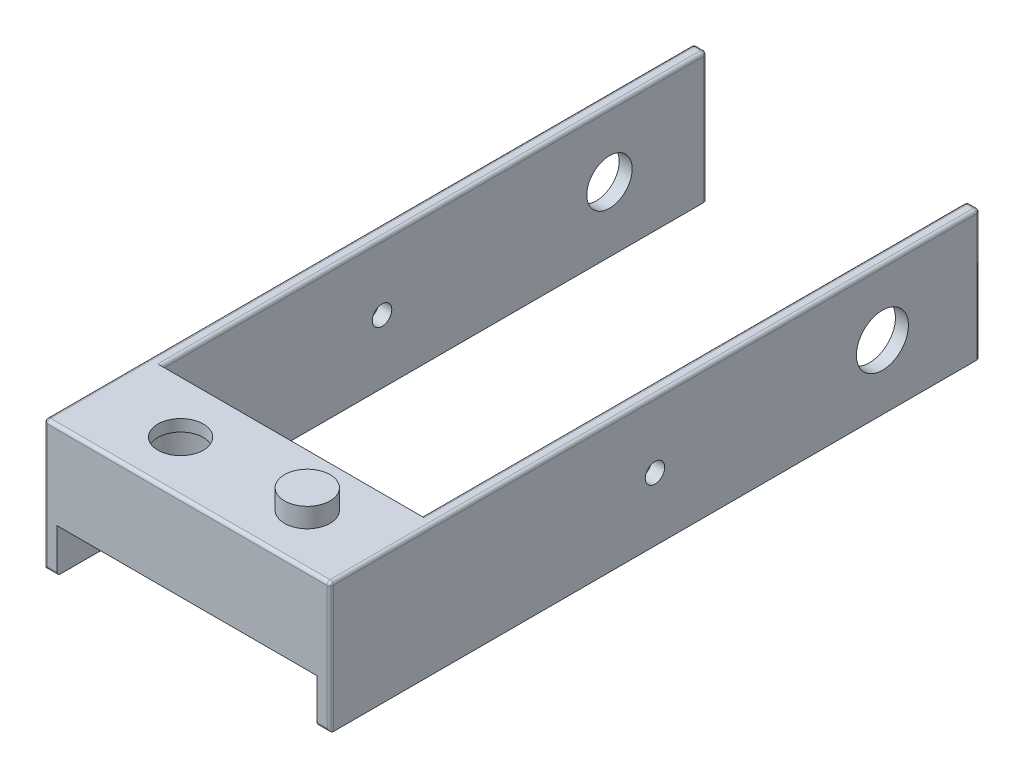
from build123d import *

# Parameters (mm, degrees)
SKETCH1_W           = 40
SKETCH1_H           = 16
BOSS_EXTRUDE1_DEPTH = 13.3
CUT_EXTRUDE2_DEPTH  = 11.5
SKETCH3_R           = 3.5
CUT_EXTRUDE3_DEPTH  = 24.8
SKETCH4_W           = 21
SKETCH4_H           = 12
CUT_EXTRUDE4_DEPTH  = 4
SKETCH5_W           = 100
SKETCH5_H           = 20
BOSS_EXTRUDE2_DEPTH = 2
SKETCH6_W           = 100
SKETCH6_H           = 20
BOSS_EXTRUDE3_DEPTH = 2
SKETCH7_R           = 4
CUT_EXTRUDE5_DEPTH  = 2
CUT_EXTRUDE8_REACH  = 104.004
SKETCH8_R           = 3.5
FILLET1_R           = 0.5
FILLET2_R           = 0.5
SKETCH9_R           = 3.5
BOSS_EXTRUDE4_DEPTH = 3
SKETCH10_R          = 1.5
CUT_EXTRUDE9_DEPTH  = 104.274827523


with BuildPart() as part:
    # Sketch1 → Boss-Extrude1 (new body)
    with BuildSketch(Plane(origin=(0, 0, 0), x_dir=(1, 0, 0), z_dir=(0, 1, 0))):
        Rectangle(SKETCH1_W, SKETCH1_H)
    extrude(amount=BOSS_EXTRUDE1_DEPTH)

    # Sketch2 → Cut-Extrude2 (cut)
    with BuildSketch(Plane.XZ):
        with BuildLine():
            ThreePointArc((-4.245094519, 3.659354296), (-14.835807847, -1.394039732), (-3.104556161, -1.115231786))
            ThreePointArc((-3.104556161, -1.115231786), (-1.705240191, 1.742549665), (-4.245094519, 3.659354296))
        make_face()
    extrude(amount=-CUT_EXTRUDE2_DEPTH, mode=Mode.SUBTRACT)

    # Sketch3 → Cut-Extrude3 (cut)
    with BuildSketch(Plane(origin=(0, 0, 0), x_dir=(-1, 0, 0), z_dir=(0, -1, 0))):
        with Locations(Location((9, 0, 0), (0, 0, 90))):
            Circle(SKETCH3_R)
    extrude(amount=-CUT_EXTRUDE3_DEPTH, mode=Mode.SUBTRACT)

    # Sketch4 → Cut-Extrude4 (cut)
    with BuildSketch(Plane(origin=(0, 0, 0), x_dir=(-1, 0, 0), z_dir=(0, -1, 0))):
        with Locations((4.5, 0)):
            Rectangle(SKETCH4_W, SKETCH4_H)
    extrude(amount=-CUT_EXTRUDE4_DEPTH, mode=Mode.SUBTRACT)

    # Sketch5 → Boss-Extrude2 (add)
    with BuildSketch(Plane(origin=(20, 0, 0), x_dir=(0, 0, -1), z_dir=(1, 0, 0))):
        with Locations((42, 3.3)):
            Rectangle(SKETCH5_W, SKETCH5_H)
    extrude(amount=BOSS_EXTRUDE2_DEPTH)

    # Sketch6 → Boss-Extrude3 (add)
    with BuildSketch(Plane.ZY.offset(20)):
        with Locations((-42, 3.3)):
            Rectangle(SKETCH6_W, SKETCH6_H)
    extrude(amount=BOSS_EXTRUDE3_DEPTH)

    # Sketch7 → Cut-Extrude5 (cut)
    with BuildSketch(Plane(origin=(22, 0, 0), x_dir=(0, 0, -1), z_dir=(1, 0, 0))):
        with Locations((77, 3.206448438)):
            Circle(SKETCH7_R)
    extrude(amount=-CUT_EXTRUDE5_DEPTH, mode=Mode.SUBTRACT)

    # Sketch8 → Cut-Extrude8 (cut, up to next)
    with BuildSketch(Plane(origin=(-20, 0, 0), x_dir=(0, 0, -1), z_dir=(1, 0, 0)), mode=Mode.PRIVATE) as cut_extrude8_sk1:
        with Locations((77, 3.3)):
            Circle(SKETCH8_R)
    cut_extrude8_tool1 = extrude(cut_extrude8_sk1.sketch, amount=-CUT_EXTRUDE8_REACH, mode=Mode.PRIVATE) & part.part
    add(cut_extrude8_tool1.solids().sort_by_distance((-20, 3.3, -77))[0], mode=Mode.SUBTRACT)

    # Fillet1
    fillet1_edges = [part.edges().sort_by_distance(p)[0] for p in [
        (20, 13.3, -50),
        (22, 13.3, -42),
        (-20, 13.3, -50),
        (-22, 13.3, -42),
    ]]
    fillet(fillet1_edges, radius=FILLET1_R)

    # Fillet2
    fillet2_edges = [part.edges().sort_by_distance(p)[0] for p in [
        (21.853553391, 13.153553391, -92),
        (20.146446609, 13.153553391, -92),
        (-20, 3.05, -92),
        (-22, 3.05, -92),
        (-21.853553391, 13.153553391, -92),
        (-20.146446609, 13.153553391, -92),
        (22, 3.05, 8),
        (21.853553391, 13.153553391, 8),
        (-21.853553391, 13.153553391, 8),
        (21, -6.7, 8),
        (20, 3.05, -92),
        (21, -6.7, -92),
        (22, 3.05, -92),
        (-21, -6.7, 8),
        (-21, -6.7, -92),
        (-22, 3.05, 8),
        (0, 13.3, 8),
        (21, 13.3, -92),
        (-21, 13.3, -92),
    ]]
    fillet(fillet2_edges, radius=FILLET2_R)

    # Sketch9 → Boss-Extrude4 (add)
    with BuildSketch(Plane(origin=(0, 13.3, 0), x_dir=(1, 0, 0), z_dir=(0, 1, 0))):
        with Locations(Location((10.5, 0, 0), (0, 0, 270))):
            Circle(SKETCH9_R)
    extrude(amount=BOSS_EXTRUDE4_DEPTH)

    # Sketch10 → Cut-Extrude9 (cut, through all)
    with BuildSketch(Plane.ZY.offset(22)):
        with Locations((-42, 3.05)):
            Circle(SKETCH10_R)
    extrude(amount=-CUT_EXTRUDE9_DEPTH, mode=Mode.SUBTRACT)


solid = part.part
